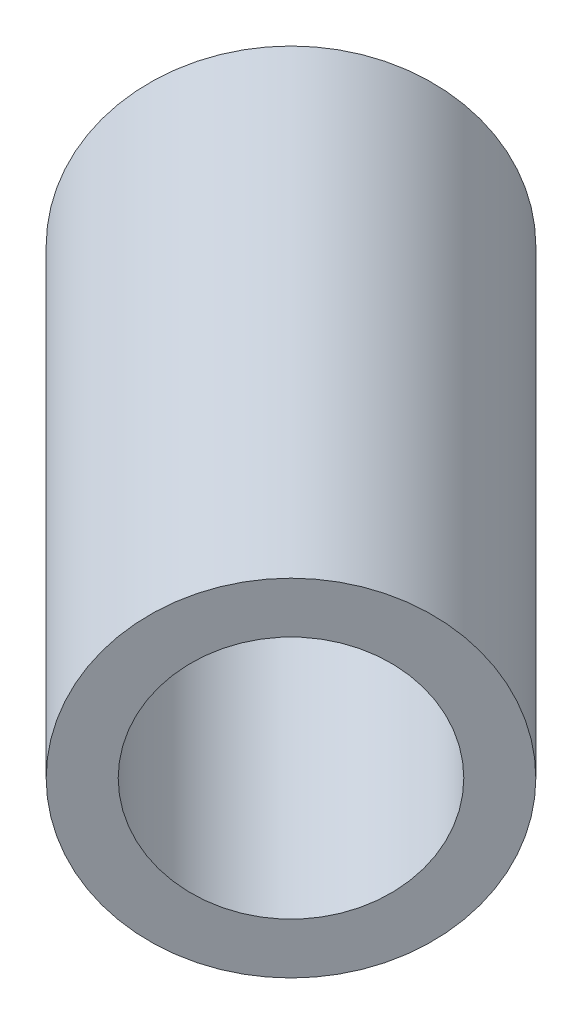
from build123d import *

# Parameters (mm, degrees)
SWEEP1_PROFILE_R     = 13.49375
CUT_SWEEP1_PROFILE_R = 9.525


with BuildPart() as part:
    # Sweep1: sweep along a path in Sketch1
    with BuildLine(Plane(origin=(0, 0, 0), x_dir=(1, 0, 0), z_dir=(0, 1, 0))) as sweep1_path:
        Line((0, 0), (-35.921024484, 35.921024484))
    # Sweep1 profile (on start of the path) → Sweep1 (sweep)
    with BuildSketch(Plane(origin=(0, 0, 0), x_dir=(-0.7071067811865476, 0, 0.7071067811865476), z_dir=(-0.7071067811865476, 0, -0.7071067811865476))):
        Circle(SWEEP1_PROFILE_R)
    sweep(path=sweep1_path.line)

    # Cut-Sweep1: sweep along a path in Sketch1<3>
    with BuildLine(Plane(origin=(0, 0, 0), x_dir=(1, 0, 0), z_dir=(0, 1, 0))) as cut_sweep1_path:
        Line((0, 0), (-35.921024484, 35.921024484))
    # Cut-Sweep1 profile (on start of the path) → Cut-Sweep1 (sweep, cut)
    with BuildSketch(Plane(origin=(0, 0, 0), x_dir=(-0.7071067811865476, 0, 0.7071067811865476), z_dir=(-0.7071067811865476, 0, -0.7071067811865476))):
        Circle(CUT_SWEEP1_PROFILE_R)
    sweep(path=cut_sweep1_path.line, mode=Mode.SUBTRACT)


solid = part.part
